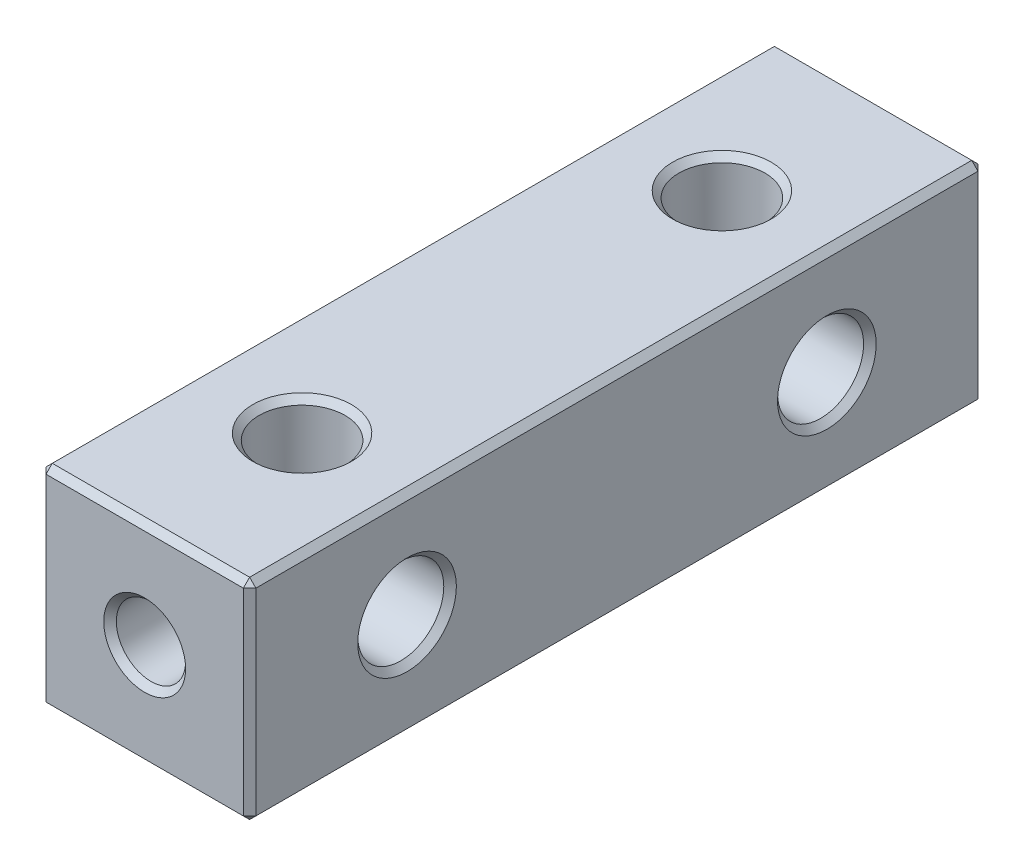
from build123d import *

# Parameters (mm, degrees)
SKETCH_1_W              = 10
SKETCH_1_H              = 10
EXTRUDE_1_DEPTH         = 17.5
HOLE_WIZARD_4_1_4_1_1_D = 4.1
HOLE_WIZARD_4_1_4_1_2_D = 4.1
HOLE_WIZARD_M4_1_REACH  = 37.707
HOLE_WIZARD_M4_1_BORE_R = 1.65
HOLE_WIZARD_M4_2_REACH  = 37.707
HOLE_WIZARD_M4_2_BORE_R = 1.65
CHAMFER_1_SIZE          = 0.3


with BuildPart() as part:
    # 草图1 → 凸台-拉伸1 (new, symmetric)
    with BuildSketch(Plane.XY):
        Rectangle(SKETCH_1_W, SKETCH_1_H)
    extrude(amount=EXTRUDE_1_DEPTH, both=True)

    # Ø4.1 (4.1) 直径孔1 (through all)
    with Locations(Plane(origin=(5, 0, 0), x_dir=(0, 0, -1), z_dir=(1, 0, 0))):
        with Locations((-10, 0), (10, 0)):
            Hole(HOLE_WIZARD_4_1_4_1_1_D / 2)

    # Ø4.1 (4.1) 直径孔2 (through all)
    with Locations(Plane(origin=(0, 5, 0), x_dir=(1, 0, 0), z_dir=(0, 1, 0))):
        with Locations((0, -10), (0, 10)):
            Hole(HOLE_WIZARD_4_1_4_1_2_D / 2)

    # M4 螺纹孔1 bore → M4 螺纹孔1 (cut, up to next)
    with BuildSketch(Plane.XY.offset(17.5), mode=Mode.PRIVATE) as hole_wizard_m4_1_sk1:
        Circle(HOLE_WIZARD_M4_1_BORE_R)
    hole_wizard_m4_1_tool1 = extrude(hole_wizard_m4_1_sk1.sketch, amount=-HOLE_WIZARD_M4_1_REACH, mode=Mode.PRIVATE) & part.part
    add(hole_wizard_m4_1_tool1.solids().sort_by_distance((0, 0, 17.5))[0], mode=Mode.SUBTRACT)

    # M4 螺纹孔2 bore → M4 螺纹孔2 (cut, up to next)
    with BuildSketch(Plane(origin=(0, 0, -17.5), x_dir=(-1, 0, 0), z_dir=(0, 0, -1)), mode=Mode.PRIVATE) as hole_wizard_m4_2_sk1:
        Circle(HOLE_WIZARD_M4_2_BORE_R)
    hole_wizard_m4_2_tool1 = extrude(hole_wizard_m4_2_sk1.sketch, amount=-HOLE_WIZARD_M4_2_REACH, mode=Mode.PRIVATE) & part.part
    add(hole_wizard_m4_2_tool1.solids().sort_by_distance((0, 0, -17.5))[0], mode=Mode.SUBTRACT)

    # 倒角1
    chamfer_1_edges = [part.edges().sort_by_distance(p)[0] for p in [
        (-5, 0, 17.5),
        (5, 0, -12.05),
        (-5, 0, -12.05),
        (0, -5, 17.5),
        (5, 0, 7.95),
        (-5, 0, 7.95),
        (2.05, -5, -10),
        (2.05, 5, -10),
        (2.05, -5, 10),
        (2.05, 5, 10),
        (5, 0, 17.5),
        (0, -5, -17.5),
        (-5, 0, -17.5),
        (-1.65, 0, 17.5),
        (0, 5, -17.5),
        (5, 0, -17.5),
        (1.65, 0, -17.5),
        (5, -5, 0),
        (-5, -5, 0),
        (-5, 5, 0),
        (5, 5, 0),
        (0, 5, 17.5),
    ]]
    chamfer(chamfer_1_edges, length=CHAMFER_1_SIZE)


solid = part.part
